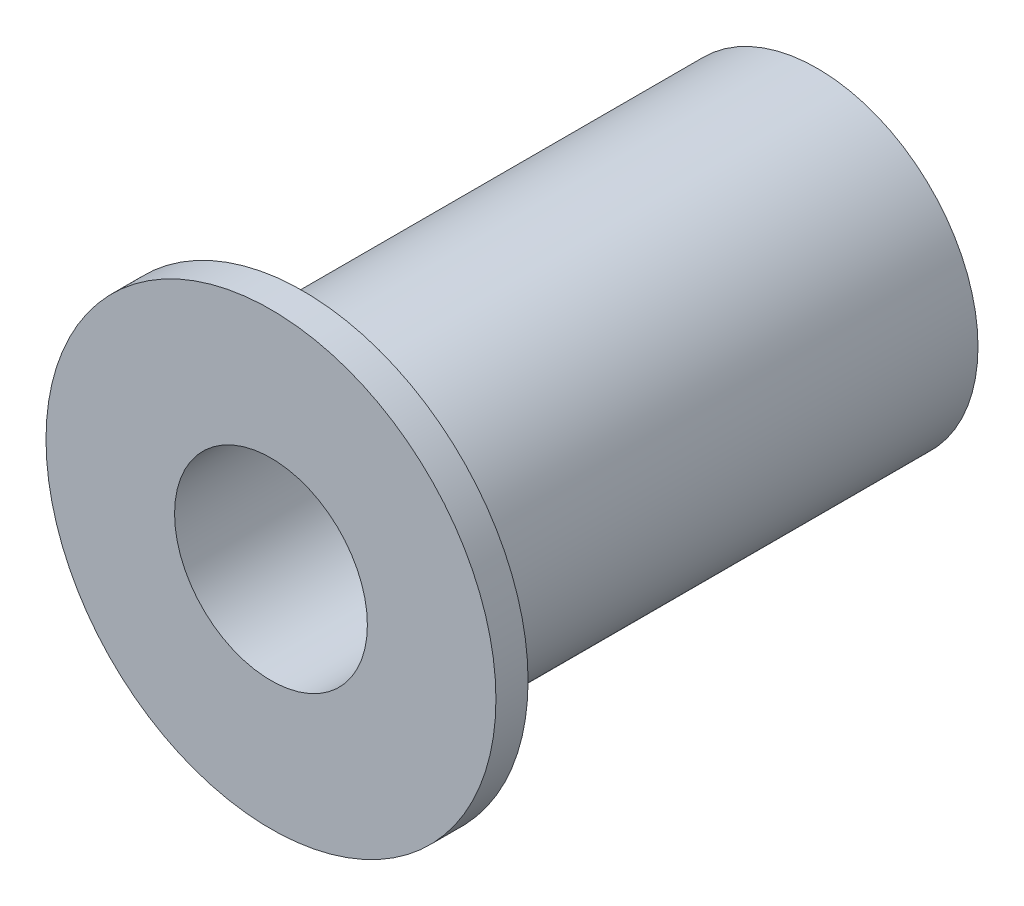
from build123d import *

# Parameters (mm, degrees)
SKETCH1_R           = 7.9375
SKETCH1_R_2         = 4.7625
BOSS_EXTRUDE1_DEPTH = 12.7
SKETCH2_R           = 11.1125
SKETCH2_R_2         = 4.7625
BOSS_EXTRUDE2_DEPTH = 1.5875


with BuildPart() as part:
    # Sketch1 → Boss-Extrude1 (new, symmetric)
    with BuildSketch(Plane.XY):
        Circle(SKETCH1_R)
        Circle(SKETCH1_R_2, mode=Mode.SUBTRACT)
    extrude(amount=BOSS_EXTRUDE1_DEPTH, both=True)

    # Sketch2 → Boss-Extrude2 (add)
    with BuildSketch(Plane.XY.offset(12.7)):
        Circle(SKETCH2_R)
        Circle(SKETCH2_R_2, mode=Mode.SUBTRACT)
    extrude(amount=BOSS_EXTRUDE2_DEPTH)


solid = part.part
